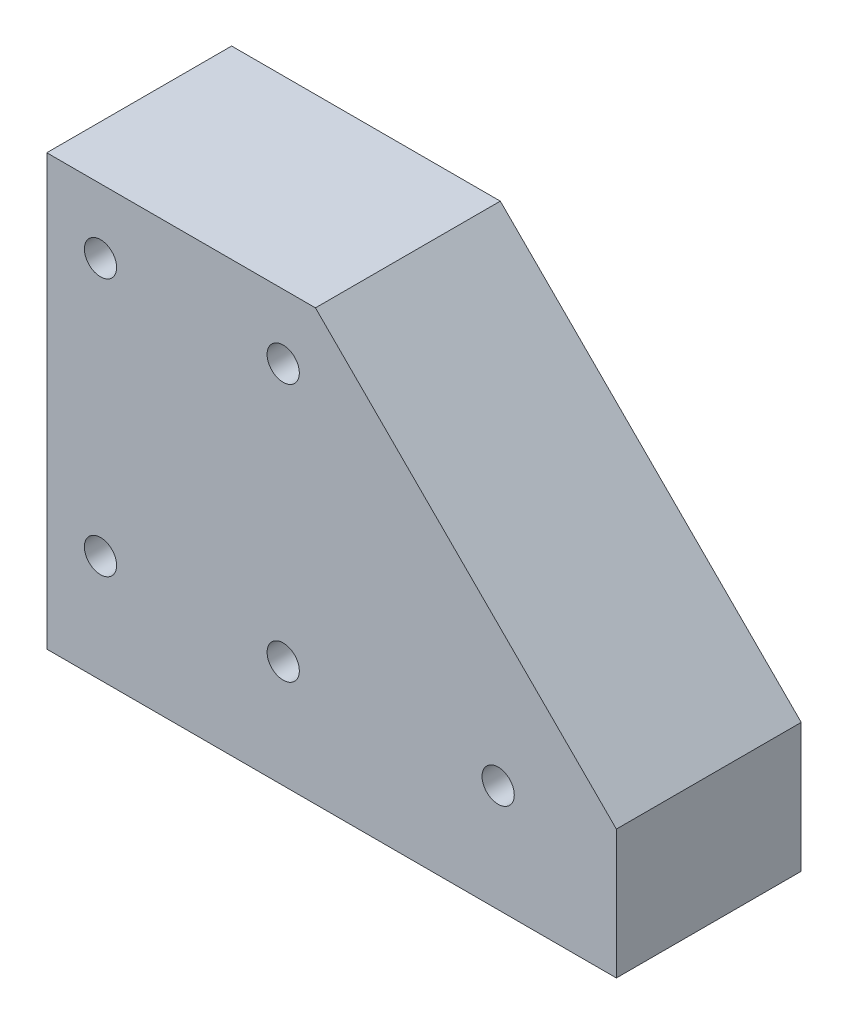
from build123d import *

# Parameters (mm, degrees)
SKETCH_1_W          = 53
SKETCH_1_H          = 40
EXTRUDE_1_DEPTH     = 17.2
CUT_EXTRUDE_1_DEPTH = 69.591836249
SKETCH_3_R          = 1.5
CUT_EXTRUDE_2_DEPTH = 69.591836249


with BuildPart() as part:
    # 草图1 → 凸台-拉伸1 (new body)
    with BuildSketch(Plane.XY):
        with Locations((26.5, 20)):
            Rectangle(SKETCH_1_W, SKETCH_1_H)
    extrude(amount=EXTRUDE_1_DEPTH)

    # 草图2 → 切除-拉伸1 (cut, through all)
    with BuildSketch(Plane.XY.offset(17.2)):
        Polygon((25, 40), (53, 40), (53, 12), align=None)
    extrude(amount=-CUT_EXTRUDE_1_DEPTH, mode=Mode.SUBTRACT)

    # 草图3 → 切除-拉伸2 (cut, through all)
    with BuildSketch(Plane.XY.offset(17.2)):
        with Locations((5, 34)):
            Circle(SKETCH_3_R)
        with Locations((5, 10)):
            Circle(SKETCH_3_R)
        with Locations((22, 34)):
            Circle(SKETCH_3_R)
        with Locations((22, 10)):
            Circle(SKETCH_3_R)
        with Locations((42, 10)):
            Circle(SKETCH_3_R)
    extrude(amount=-CUT_EXTRUDE_2_DEPTH, mode=Mode.SUBTRACT)


solid = part.part
